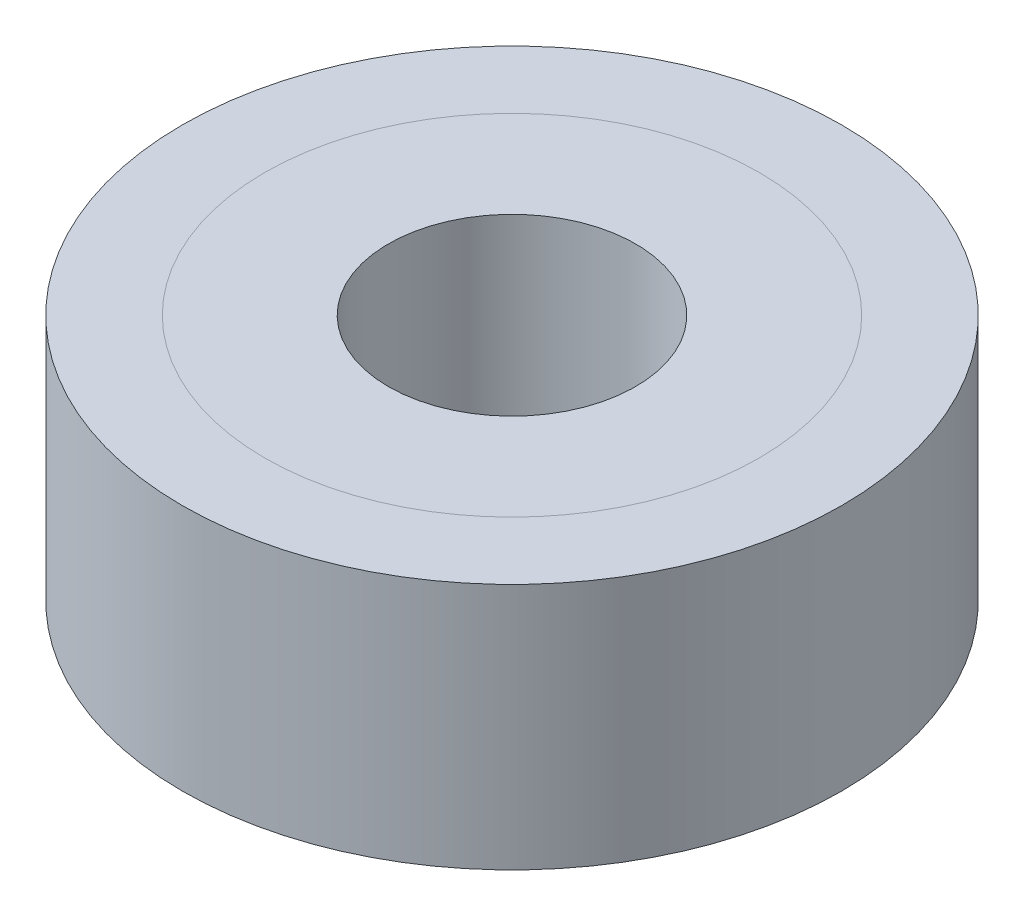
from build123d import *

# Parameters (mm, degrees)
SKETCH_1_R                     = 4
SKETCH_1_R_2                   = 1.5
EXTRUDE_1_DEPTH                = 3
SPLIT_BODIES_1_SURFACE_1_BACK  = 12.705
SPLIT_BODIES_1_SURFACE_1_DEPTH = 25.41
SPLIT_BODIES_1_SURFACE_2_BACK  = 12.705
SPLIT_BODIES_1_SURFACE_2_DEPTH = 25.41


with BuildPart() as part:
    # 草图1 → 凸台-拉伸1 (new body)
    with BuildSketch(Plane(origin=(0, 0, 0), x_dir=(1, 0, 0), z_dir=(0, 1, 0))):
        with Locations(Location((0, 0, 0), (0, 0, 270))):
            Circle(SKETCH_1_R)
        with Locations(Location((0, 0, 0), (0, 0, 270))):
            Circle(SKETCH_1_R_2, mode=Mode.SUBTRACT)
    extrude(amount=EXTRUDE_1_DEPTH)


with BuildPart() as body_2:
    # Split Bodies 1: the piece behind the surface
    add(part.part)
    # Split Bodies 1 surface: a surface, the sketch's curves swept straight by 25.41 mm
    with BuildLine(Plane(origin=(0, 3, 0), x_dir=(1, 0, 0), z_dir=(0, 1, 0)).offset(-SPLIT_BODIES_1_SURFACE_1_BACK), mode=Mode.PRIVATE) as split_bodies_1_surface_1_path:
        CenterArc((0, 0), 3, 0, 360)
    split_bodies_1_surface_1 = Shell.extrude(split_bodies_1_surface_1_path.wire(), (0 * SPLIT_BODIES_1_SURFACE_1_DEPTH, 1 * SPLIT_BODIES_1_SURFACE_1_DEPTH, 0 * SPLIT_BODIES_1_SURFACE_1_DEPTH))
    split(bisect_by=split_bodies_1_surface_1, keep=Keep.BOTTOM)


with BuildPart() as part_1:
    add(part.part)

    # Split Bodies 1: split by a surface, the side it looks to stays
    # Split Bodies 1 surface: a surface, the sketch's curves swept straight by 25.41 mm
    with BuildLine(Plane(origin=(0, 3, 0), x_dir=(1, 0, 0), z_dir=(0, 1, 0)).offset(-SPLIT_BODIES_1_SURFACE_2_BACK), mode=Mode.PRIVATE) as split_bodies_1_surface_2_path:
        CenterArc((0, 0), 3, 0, 360)
    split_bodies_1_surface_2 = Shell.extrude(split_bodies_1_surface_2_path.wire(), (0 * SPLIT_BODIES_1_SURFACE_2_DEPTH, 1 * SPLIT_BODIES_1_SURFACE_2_DEPTH, 0 * SPLIT_BODIES_1_SURFACE_2_DEPTH))
    split(bisect_by=split_bodies_1_surface_2, keep=Keep.TOP)


solid = Compound([body_2.part, part_1.part])
